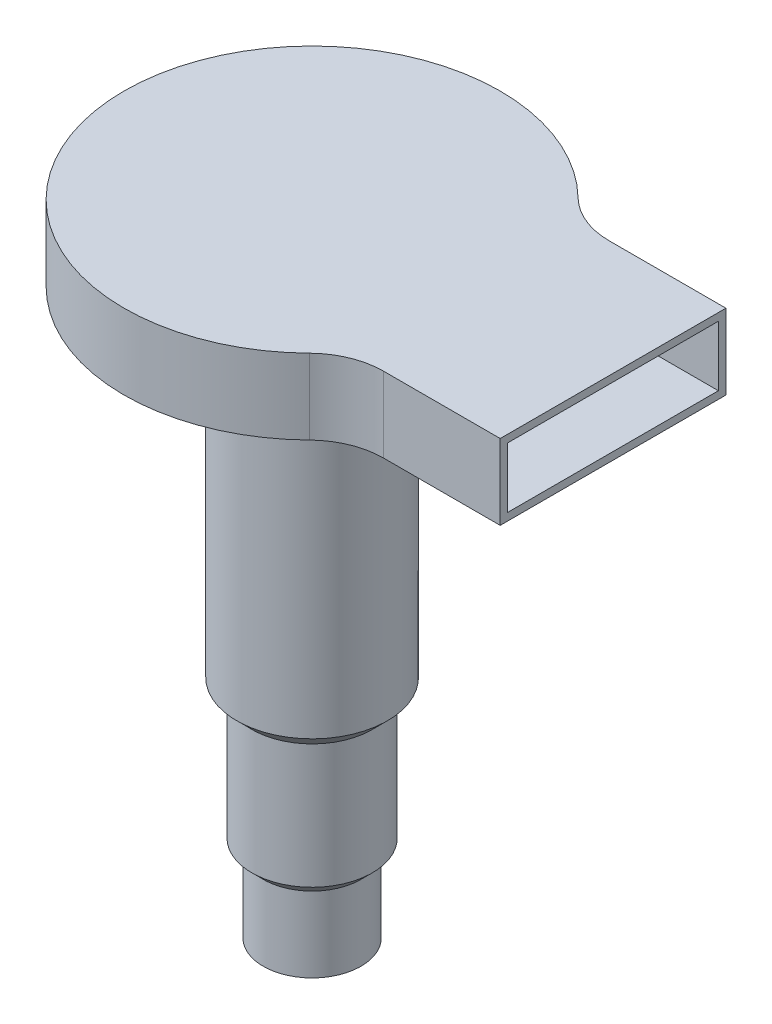
from build123d import *

# Parameters (mm, degrees)
BOSS_EXTRUDE1_DEPTH = 10
SHELL1_T            = -1


with BuildPart() as part:
    # Sketch1 → Revolve1 (revolve)
    with BuildSketch(Plane(origin=(0, 0, 0), x_dir=(0, 0, -1), z_dir=(1, 0, 0))):
        Polygon((5, 0), (6.5, 0), (6.5, 10), (8, 11.5), (8, 28), (10, 30), (10, 70), (12, 70), (12, 75), (0, 75), (0, 35), (5, 35), align=None)
    revolve(axis=Axis((0, 0, 0), (0, 1, 0)))


with BuildPart() as body_2:
    # Sketch2 → Boss-Extrude1 (new body)
    with BuildSketch(Plane(origin=(0, 75, 0), x_dir=(1, 0, 0), z_dir=(0, 1, 0))):
        with BuildLine():
            Line((24.494897428, 15), (40, 15))
            Line((40, 15), (40, -15))
            Line((40, -15), (24.494897428, -15))
            ThreePointArc((24.494897428, -15), (20.715252698, -15.741799002), (17.496355306, -17.857142857))
            ThreePointArc((17.496355306, -17.857142857), (-25, 0), (17.496355306, 17.857142857))
            ThreePointArc((17.496355306, 17.857142857), (20.715252698, 15.741799002), (24.494897428, 15))
        make_face()
    extrude(amount=BOSS_EXTRUDE1_DEPTH)

    # Shell1
    shell1_openings = [body_2.faces().sort_by_distance(p)[0] for p in [
        (40, 80, 0),
    ]]
    offset(amount=SHELL1_T, openings=shell1_openings, kind=Kind.INTERSECTION)

    # Combine1: union part
    add(part.part)


solid = body_2.part
